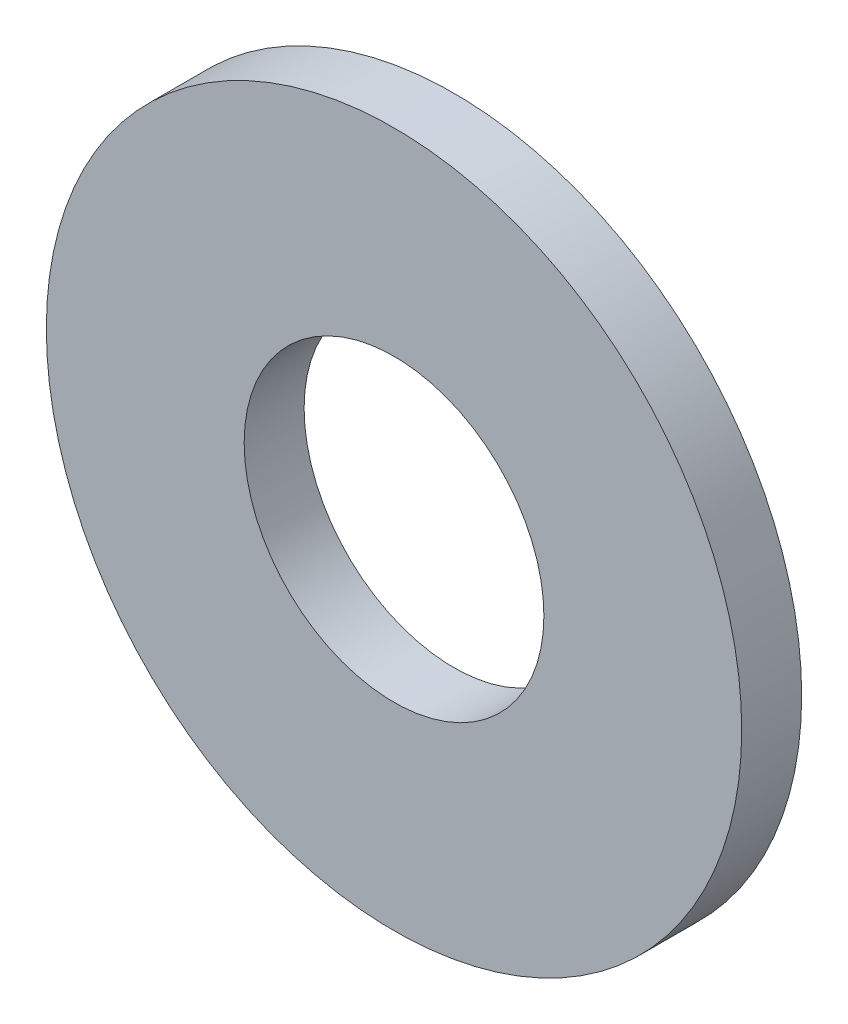
from build123d import *

# Parameters (mm, degrees)
ESQUISSE1_R        = 5.8
ESQUISSE1_R_2      = 2.5
BOSS_EXTRU_1_DEPTH = 1


with BuildPart() as part:
    # Esquisse1 → Boss.-Extru.1 (new body)
    with BuildSketch(Plane.XY):
        Circle(ESQUISSE1_R)
        Circle(ESQUISSE1_R_2, mode=Mode.SUBTRACT)
    extrude(amount=BOSS_EXTRU_1_DEPTH)


solid = part.part
